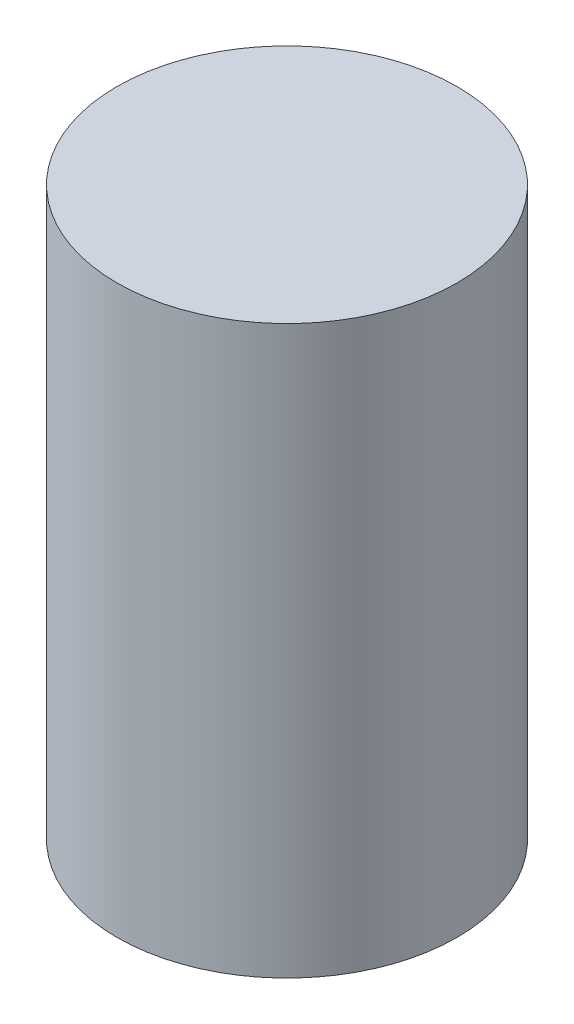
from build123d import *

# Parameters (mm, degrees)
SKETCH1_R           = 60
BOSS_EXTRUDE1_DEPTH = 200


with BuildPart() as part:
    # Sketch1 → Boss-Extrude1 (new body)
    with BuildSketch(Plane(origin=(0, 0, 0), x_dir=(1, 0, 0), z_dir=(0, 1, 0))):
        with Locations(Location((0, 0, 0), (0, 0, 270))):
            Circle(SKETCH1_R)
    extrude(amount=BOSS_EXTRUDE1_DEPTH)


solid = part.part
